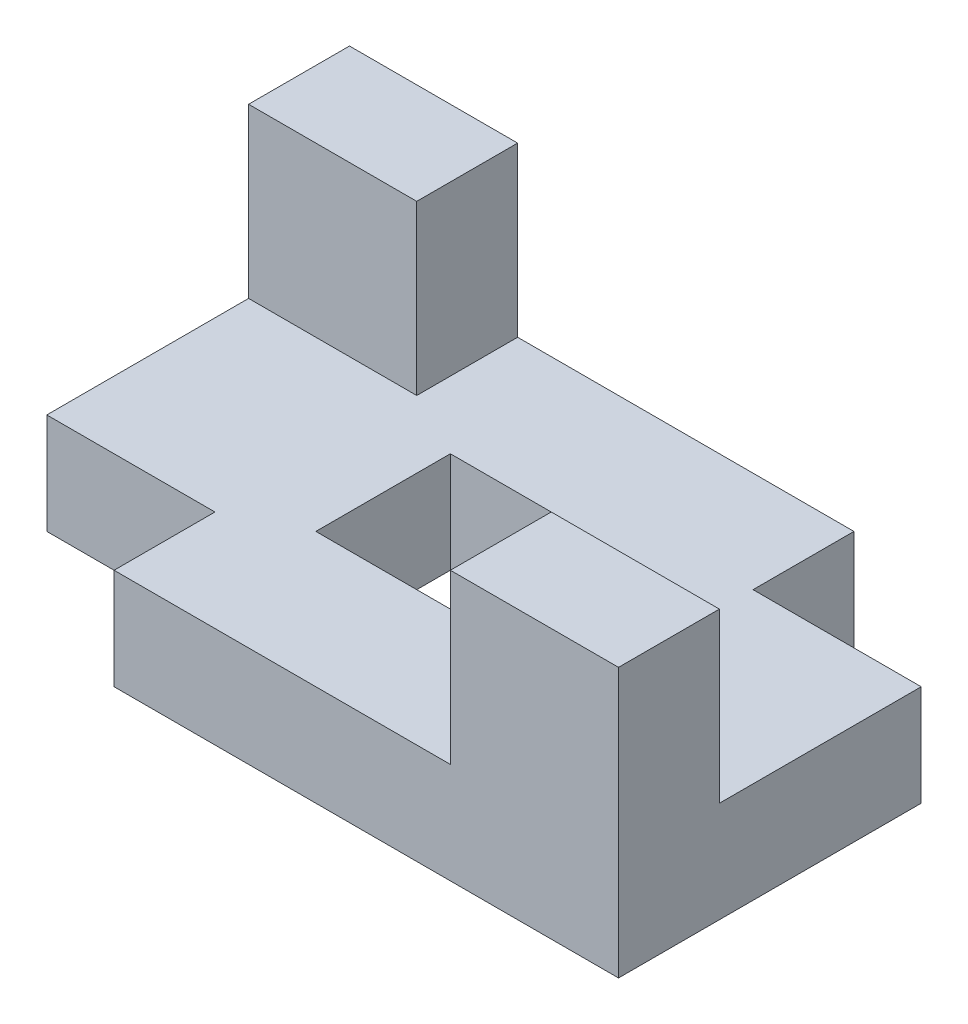
from build123d import *

# Parameters (mm, degrees)
SKETCH1_W           = 100
SKETCH1_H           = 60
BOSS_EXTRUDE1_DEPTH = 15
SKETCH2_W           = 25
SKETCH2_H           = 15
BOSS_EXTRUDE2_DEPTH = 25
SKETCH3_W           = 25
SKETCH3_H           = 15
CUT_EXTRUDE1_DEPTH  = 15
SKETCH4_W           = 30
SKETCH4_H           = 20
CUT_EXTRUDE2_DEPTH  = 15


with BuildPart() as part:
    # Sketch1 → Boss-Extrude1 (new body)
    with BuildSketch(Plane(origin=(0, 0, 0), x_dir=(1, 0, 0), z_dir=(0, 1, 0))):
        Rectangle(SKETCH1_W, SKETCH1_H)
    extrude(amount=BOSS_EXTRUDE1_DEPTH)

    # Sketch2 → Boss-Extrude2 (add)
    with BuildSketch(Plane(origin=(0, 15, 0), x_dir=(1, 0, 0), z_dir=(0, 1, 0))):
        with Locations((-37.5, 22.5)):
            Rectangle(SKETCH2_W, SKETCH2_H)
        with Locations((37.5, -22.5)):
            Rectangle(SKETCH2_W, SKETCH2_H)
    extrude(amount=BOSS_EXTRUDE2_DEPTH)

    # Sketch3 → Cut-Extrude1 (cut)
    with BuildSketch(Plane(origin=(0, 15, 0), x_dir=(1, 0, 0), z_dir=(0, 1, 0))):
        with Locations((-37.5, -22.5)):
            Rectangle(SKETCH3_W, SKETCH3_H)
        with Locations((37.5, 22.5)):
            Rectangle(SKETCH3_W, SKETCH3_H)
    extrude(amount=-CUT_EXTRUDE1_DEPTH, mode=Mode.SUBTRACT)

    # Sketch4 → Cut-Extrude2 (cut)
    with BuildSketch(Plane(origin=(0, 15, 0), x_dir=(1, 0, 0), z_dir=(0, 1, 0))):
        Rectangle(SKETCH4_W, SKETCH4_H)
    extrude(amount=-CUT_EXTRUDE2_DEPTH, mode=Mode.SUBTRACT)


solid = part.part
